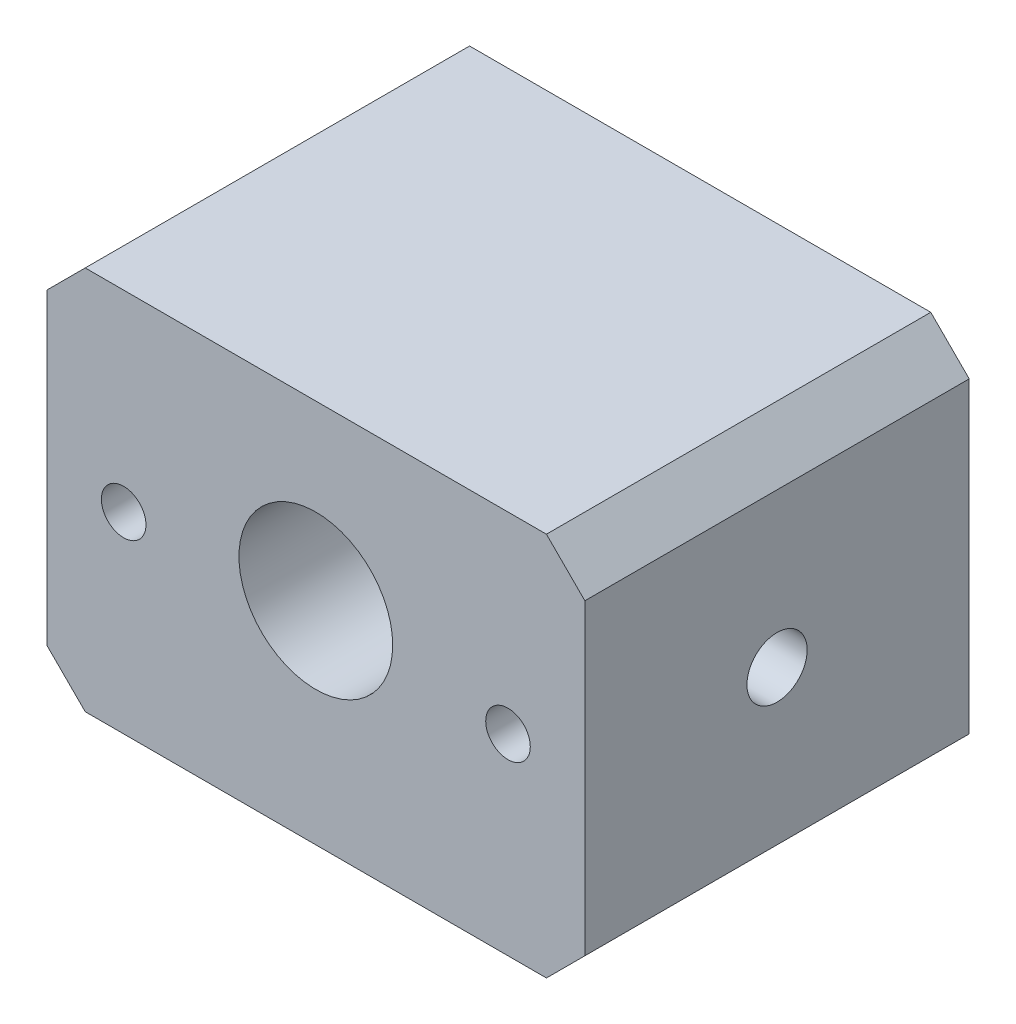
from build123d import *

# Parameters (mm, degrees)
SKETCH1_W           = 44.45
SKETCH1_H           = 31.75
SKETCH1_R           = 1.8415
SKETCH1_R_2         = 6.35
BOSS_EXTRUDE1_DEPTH = 31.75
CHAMFER1_SIZE       = 3.175
SKETCH2_R           = 2.4892
CUT_EXTRUDE1_DEPTH  = 57.884801353


with BuildPart() as part:
    # Sketch1 → Boss-Extrude1 (new body)
    with BuildSketch(Plane.XY):
        Rectangle(SKETCH1_W, SKETCH1_H)
        with Locations((-15.875, 0)):
            Circle(SKETCH1_R, mode=Mode.SUBTRACT)
        with Locations((15.875, 0)):
            Circle(SKETCH1_R, mode=Mode.SUBTRACT)
        with Locations((0, 1.5875)):
            Circle(SKETCH1_R_2, mode=Mode.SUBTRACT)
    extrude(amount=BOSS_EXTRUDE1_DEPTH)

    # Chamfer1
    chamfer1_edges = [part.edges().sort_by_distance(p)[0] for p in [
        (22.225, -15.875, 15.875),
        (-22.225, -15.875, 15.875),
        (-22.225, 15.875, 15.875),
        (22.225, 15.875, 15.875),
    ]]
    chamfer(chamfer1_edges, length=CHAMFER1_SIZE)

    # Sketch2 → Cut-Extrude1 (cut, through all)
    with BuildSketch(Plane(origin=(22.225, 0, 0), x_dir=(0, 0, -1), z_dir=(1, 0, 0))):
        with Locations((-15.875, 0)):
            Circle(SKETCH2_R)
    extrude(amount=-CUT_EXTRUDE1_DEPTH, mode=Mode.SUBTRACT)


solid = part.part
